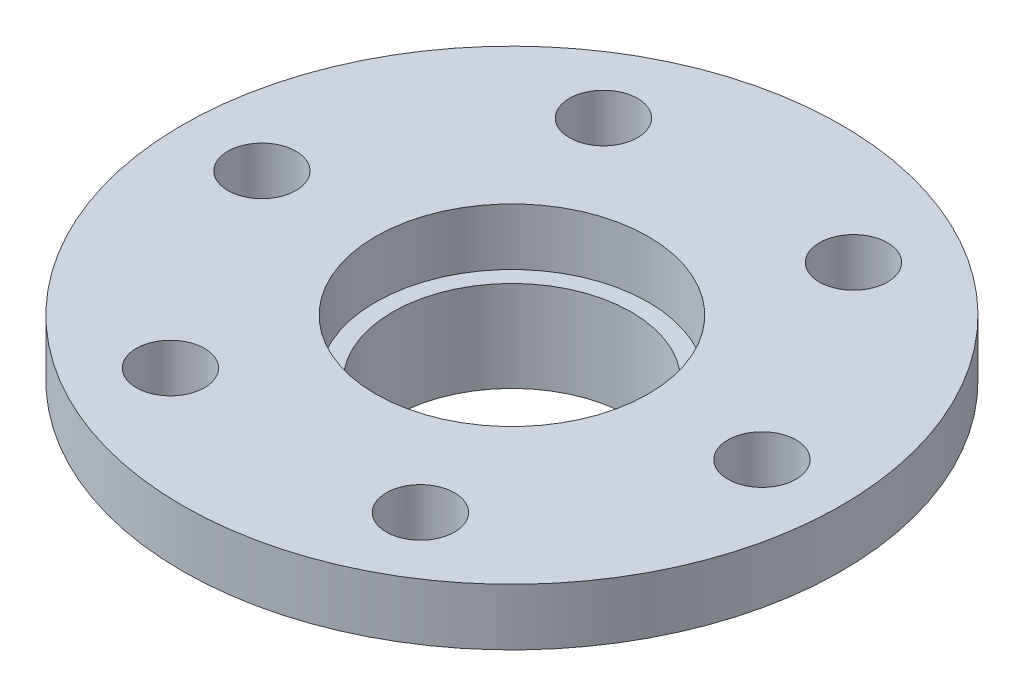
from build123d import *

# Parameters (mm, degrees)
SKETCH1_R           = 17.5
BOSS_EXTRUDE1_DEPTH = 8
SKETCH2_R           = 29
BOSS_EXTRUDE2_DEPTH = 5
SKETCH3_R           = 12
CUT_EXTRUDE1_DEPTH  = 5
SKETCH4_R           = 10.5
CUT_EXTRUDE2_DEPTH  = 42.785164832
CUT_EXTRUDE3_REACH  = 43.785
SKETCH5_R           = 3
BOSS_EXTRUDE3_START = 1
SKETCH6_R           = 18.8
SKETCH6_R_2         = 17.5
BOSS_EXTRUDE3_DEPTH = 1


with BuildPart() as part:
    # Sketch1 → Boss-Extrude1 (new body)
    with BuildSketch(Plane(origin=(0, 0, 0), x_dir=(1, 0, 0), z_dir=(0, 1, 0))):
        with Locations(Location((0, 0, 0), (0, 0, 270))):
            Circle(SKETCH1_R)
    extrude(amount=BOSS_EXTRUDE1_DEPTH)

    # Sketch2 → Boss-Extrude2 (add)
    with BuildSketch(Plane(origin=(0, 8, 0), x_dir=(1, 0, 0), z_dir=(0, 1, 0))):
        with Locations(Location((0, 0, 0), (0, 0, 270))):
            Circle(SKETCH2_R)
    extrude(amount=BOSS_EXTRUDE2_DEPTH)

    # Sketch3 → Cut-Extrude1 (cut)
    with BuildSketch(Plane(origin=(0, 13, 0), x_dir=(1, 0, 0), z_dir=(0, 1, 0))):
        with Locations(Location((0, 0, 0), (0, 0, 270))):
            Circle(SKETCH3_R)
    extrude(amount=-CUT_EXTRUDE1_DEPTH, mode=Mode.SUBTRACT)

    # Sketch4 → Cut-Extrude2 (cut, through all)
    with BuildSketch(Plane(origin=(0, 8, 0), x_dir=(1, 0, 0), z_dir=(0, 1, 0))):
        with Locations(Location((0, 0, 0), (0, 0, 270))):
            Circle(SKETCH4_R)
    extrude(amount=-CUT_EXTRUDE2_DEPTH, mode=Mode.SUBTRACT)

    # Sketch5 → Cut-Extrude3 (cut, up to next)
    with BuildSketch(Plane.XZ.offset(-8), mode=Mode.PRIVATE) as cut_extrude3_sk1:
        with Locations(Location((22, 0, 0), (0, 0, 270))):
            Circle(SKETCH5_R)
    cut_extrude3_tool1 = extrude(cut_extrude3_sk1.sketch, amount=-CUT_EXTRUDE3_REACH, mode=Mode.PRIVATE) & part.part
    # Sketch5 → Cut-Extrude3 (cut, up to next)
    with BuildSketch(Plane.XZ.offset(-8), mode=Mode.PRIVATE) as cut_extrude3_sk2:
        with Locations(Location((11, -19.052558883, 0), (0, 0, 270))):
            Circle(SKETCH5_R)
    cut_extrude3_tool2 = extrude(cut_extrude3_sk2.sketch, amount=-CUT_EXTRUDE3_REACH, mode=Mode.PRIVATE) & part.part
    # Sketch5 → Cut-Extrude3 (cut, up to next)
    with BuildSketch(Plane.XZ.offset(-8), mode=Mode.PRIVATE) as cut_extrude3_sk3:
        with Locations(Location((-11, -19.052558883, 0), (0, 0, 270))):
            Circle(SKETCH5_R)
    cut_extrude3_tool3 = extrude(cut_extrude3_sk3.sketch, amount=-CUT_EXTRUDE3_REACH, mode=Mode.PRIVATE) & part.part
    # Sketch5 → Cut-Extrude3 (cut, up to next)
    with BuildSketch(Plane.XZ.offset(-8), mode=Mode.PRIVATE) as cut_extrude3_sk4:
        with Locations(Location((-22, 0, 0), (0, 0, 270))):
            Circle(SKETCH5_R)
    cut_extrude3_tool4 = extrude(cut_extrude3_sk4.sketch, amount=-CUT_EXTRUDE3_REACH, mode=Mode.PRIVATE) & part.part
    # Sketch5 → Cut-Extrude3 (cut, up to next)
    with BuildSketch(Plane.XZ.offset(-8), mode=Mode.PRIVATE) as cut_extrude3_sk5:
        with Locations(Location((-11, 19.052558883, 0), (0, 0, 270))):
            Circle(SKETCH5_R)
    cut_extrude3_tool5 = extrude(cut_extrude3_sk5.sketch, amount=-CUT_EXTRUDE3_REACH, mode=Mode.PRIVATE) & part.part
    # Sketch5 → Cut-Extrude3 (cut, up to next)
    with BuildSketch(Plane.XZ.offset(-8), mode=Mode.PRIVATE) as cut_extrude3_sk6:
        with Locations(Location((11, 19.052558883, 0), (0, 0, 270))):
            Circle(SKETCH5_R)
    cut_extrude3_tool6 = extrude(cut_extrude3_sk6.sketch, amount=-CUT_EXTRUDE3_REACH, mode=Mode.PRIVATE) & part.part
    add(cut_extrude3_tool1.solids().sort_by_distance((22, 8, 0))[0], mode=Mode.SUBTRACT)
    add(cut_extrude3_tool2.solids().sort_by_distance((11, 8, -19.052559))[0], mode=Mode.SUBTRACT)
    add(cut_extrude3_tool3.solids().sort_by_distance((-11, 8, -19.052559))[0], mode=Mode.SUBTRACT)
    add(cut_extrude3_tool4.solids().sort_by_distance((-22, 8, 0))[0], mode=Mode.SUBTRACT)
    add(cut_extrude3_tool5.solids().sort_by_distance((-11, 8, 19.052559))[0], mode=Mode.SUBTRACT)
    add(cut_extrude3_tool6.solids().sort_by_distance((11, 8, 19.052559))[0], mode=Mode.SUBTRACT)

    # Sketch6 → Boss-Extrude3 (add)
    with BuildSketch(Plane.XZ.offset(-8).offset(BOSS_EXTRUDE3_START)):
        with Locations(Location((0, 0, 0), (0, 0, 90))):
            Circle(SKETCH6_R)
        with Locations(Location((0, 0, 0), (0, 0, 270))):
            Circle(SKETCH6_R_2, mode=Mode.SUBTRACT)
    extrude(amount=-BOSS_EXTRUDE3_DEPTH)


solid = part.part
